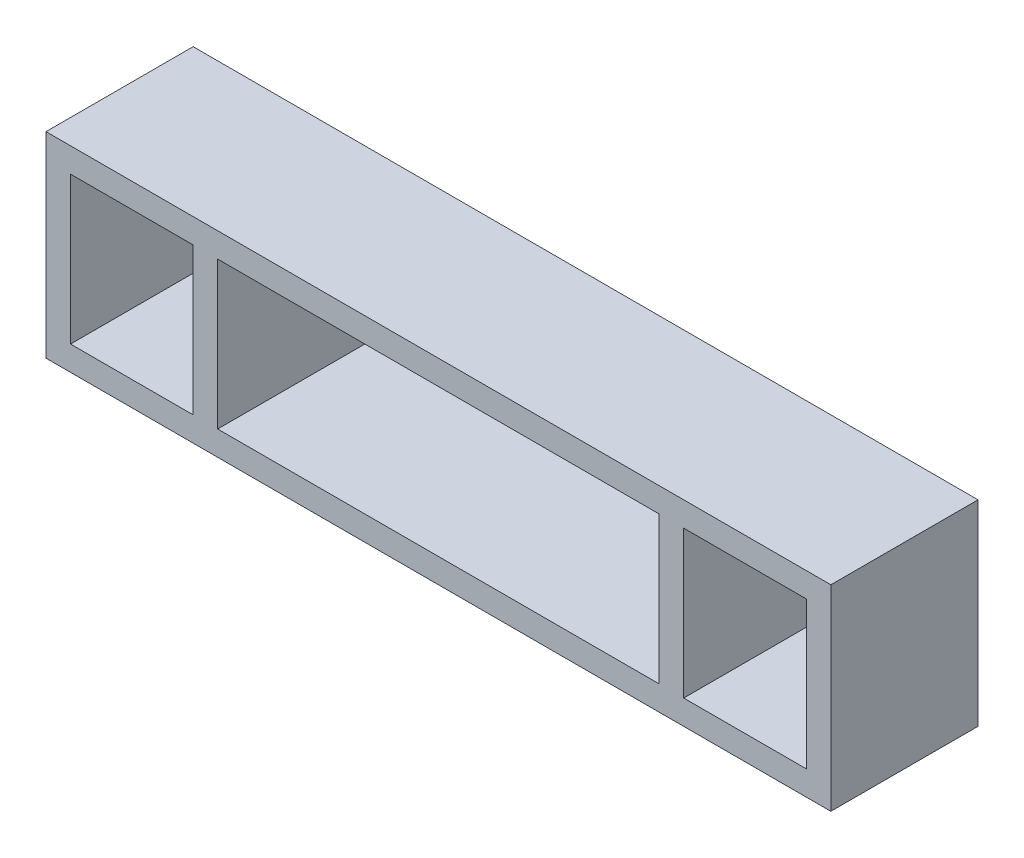
from build123d import *

# Parameters (mm, degrees)
SKETCH_8_W      = 160
SKETCH_8_H      = 40
SKETCH_8_W_2    = 25
SKETCH_8_H_2    = 30
SKETCH_8_W_3    = 90
EXTRUDE_5_DEPTH = 30


with BuildPart() as part:
    # 草图8 → 凸台-拉伸5 (new body)
    with BuildSketch(Plane.XY):
        Rectangle(SKETCH_8_W, SKETCH_8_H)
        with Locations((-62.5, 0)):
            Rectangle(SKETCH_8_W_2, SKETCH_8_H_2, mode=Mode.SUBTRACT)
        with Locations((62.5, 0)):
            Rectangle(SKETCH_8_W_2, SKETCH_8_H_2, mode=Mode.SUBTRACT)
        Rectangle(SKETCH_8_W_3, SKETCH_8_H_2, mode=Mode.SUBTRACT)
    extrude(amount=EXTRUDE_5_DEPTH)


solid = part.part
